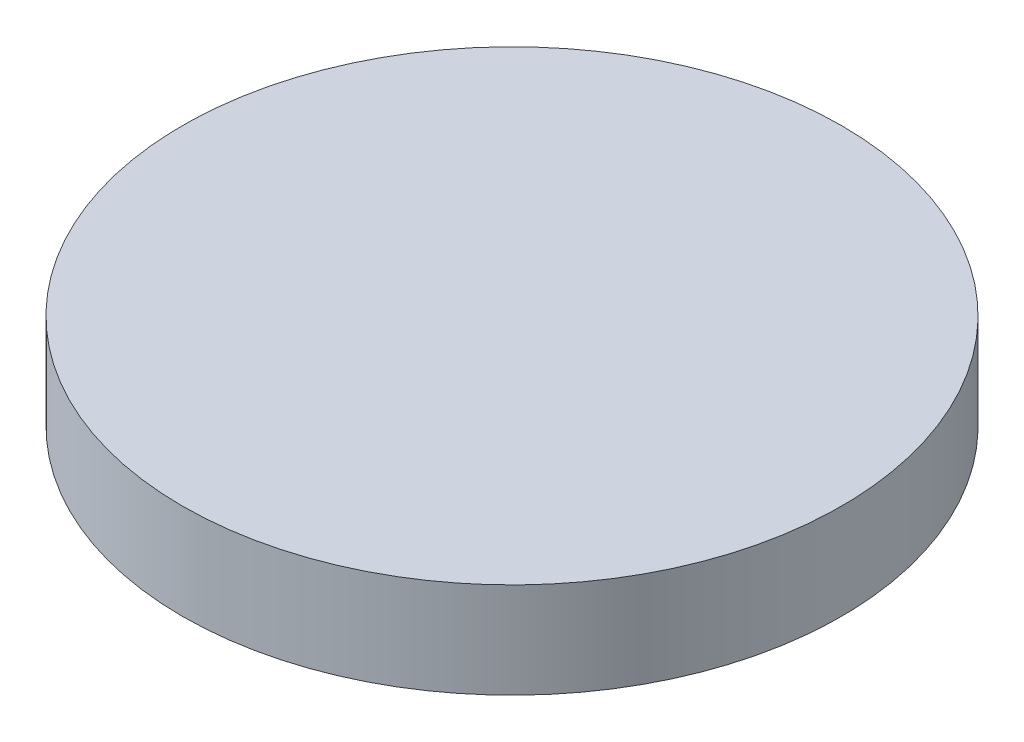
from build123d import *

# Parameters (mm, degrees)
SKETCH1_R           = 6.9
BOSS_EXTRUDE1_DEPTH = 2


with BuildPart() as part:
    # Sketch1 → Boss-Extrude1 (new body)
    with BuildSketch(Plane(origin=(0, 0, 0), x_dir=(1, 0, 0), z_dir=(0, 1, 0))):
        with Locations(Location((0, 0, 0), (0, 0, 270))):
            Circle(SKETCH1_R)
    extrude(amount=BOSS_EXTRUDE1_DEPTH)


solid = part.part
